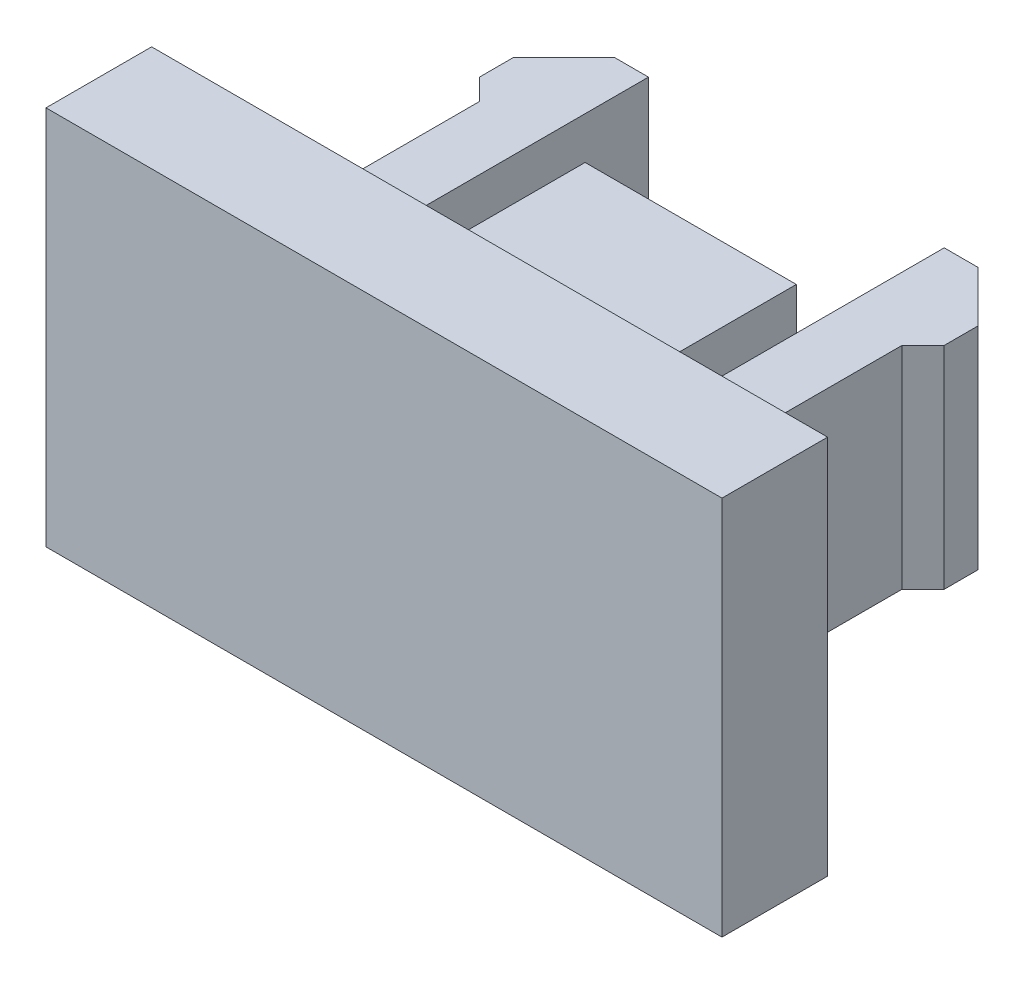
from build123d import *

# Parameters (mm, degrees)
BOSS_EXTRUDE1_DEPTH = 3.175
SKETCH2_W           = 1.27
SKETCH2_H           = 6.0452
CUT_EXTRUDE1_DEPTH  = 6.35
BOSS_EXTRUDE2_DEPTH = 5.715


with BuildPart() as part:
    # Sketch1 → Boss-Extrude1 (new, symmetric)
    with BuildSketch(Plane(origin=(0, 0, 0), x_dir=(1, 0, 0), z_dir=(0, 1, 0))):
        Polygon((3.81, 0), (0, 0), (0, -3.175), (20.32, -3.175), (20.32, 0), (16.51, 0), (16.51, 6.0452), (17.145, 6.6802), (17.145, 7.6962), (15.621, 9.2202), (14.605, 9.2202), (14.605, 6.0452), (5.715, 6.0452), (5.715, 9.2202), (4.699, 9.2202), (3.175, 7.6962), (3.175, 6.6802), (3.81, 6.0452), align=None)
    extrude(amount=BOSS_EXTRUDE1_DEPTH, both=True)

    # Sketch2 → Cut-Extrude1 (cut)
    with BuildSketch(Plane(origin=(0, 3.175, 0), x_dir=(1, 0, 0), z_dir=(0, 1, 0))):
        with Locations((6.35, 3.0226)):
            Rectangle(SKETCH2_W, SKETCH2_H)
        with Locations((13.97, 3.0226)):
            Rectangle(SKETCH2_W, SKETCH2_H)
    extrude(amount=-CUT_EXTRUDE1_DEPTH, mode=Mode.SUBTRACT)

    # Sketch1<3> → Boss-Extrude2 (add, symmetric)
    with BuildSketch(Plane(origin=(0, 0, 0), x_dir=(1, 0, 0), z_dir=(0, 1, 0))):
        Polygon((3.81, 0), (0, 0), (0, -3.175), (20.32, -3.175), (20.32, 0), (16.51, 0), align=None)
    extrude(amount=BOSS_EXTRUDE2_DEPTH, both=True)


solid = part.part
